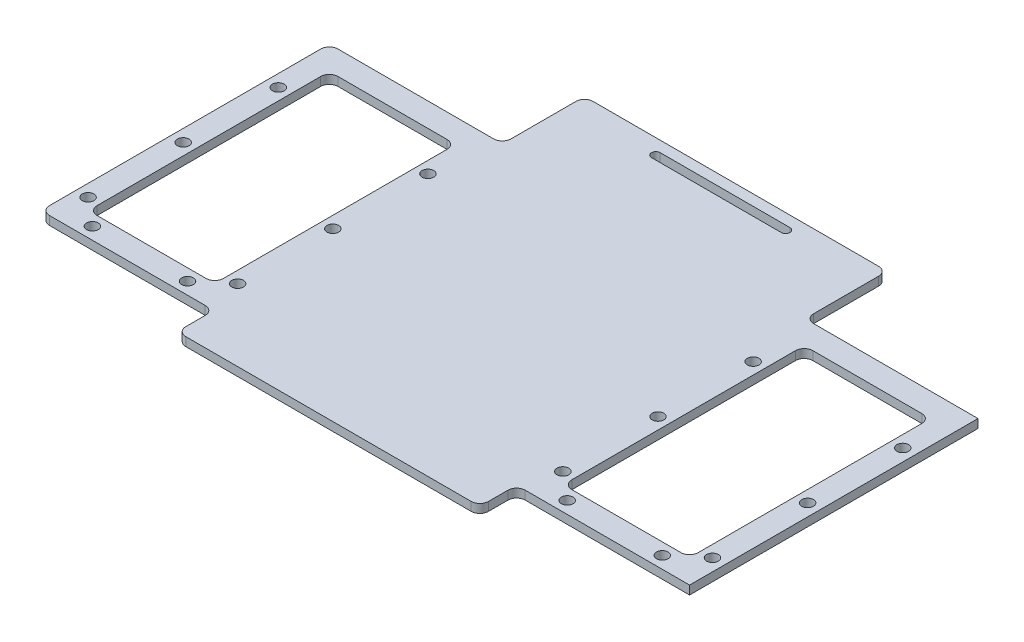
from build123d import *

# Parameters (mm, degrees)
SKETCH_1_R      = 1.35
SKETCH_1_W      = 29.2
SKETCH_1_H      = 55.7
EXTRUDE_1_DEPTH = 2
FILLET_1_R      = 2


with BuildPart() as part:
    # 草图1 → 凸台-拉伸1 (new body)
    with BuildSketch(Plane(origin=(0, 0, 0), x_dir=(1, 0, 0), z_dir=(0, 1, 0))):
        Polygon((-35, -33.35), (-35, -41.85), (35, -41.85), (35, -33.35), (75, -33.35), (75, 33.35), (35, 33.35), (35, 52.35), (-35, 52.35), (-35, 33.35), (-75, 33.35), (-75, -33.35), align=None)
        with Locations(Location((-72.2, 18.75, 0), (0, 0, 270))):
            Circle(SKETCH_1_R, mode=Mode.SUBTRACT)
        with Locations(Location((-72.2, -3.25, 0), (0, 0, 270))):
            Circle(SKETCH_1_R, mode=Mode.SUBTRACT)
        with Locations(Location((-72.2, -25.25, 0), (0, 0, 270))):
            Circle(SKETCH_1_R, mode=Mode.SUBTRACT)
        with Locations(Location((-37.6, -25.25, 0), (0, 0, 90))):
            Circle(SKETCH_1_R, mode=Mode.SUBTRACT)
        with Locations(Location((-37.6, -3.25, 0), (0, 0, 90))):
            Circle(SKETCH_1_R, mode=Mode.SUBTRACT)
        with Locations(Location((-37.6, 18.75, 0), (0, 0, 90))):
            Circle(SKETCH_1_R, mode=Mode.SUBTRACT)
        with Locations(Location((37.6, 18.75, 0), (0, 0, 270))):
            Circle(SKETCH_1_R, mode=Mode.SUBTRACT)
        with Locations(Location((37.6, -3.25, 0), (0, 0, 270))):
            Circle(SKETCH_1_R, mode=Mode.SUBTRACT)
        with Locations(Location((37.6, -25.25, 0), (0, 0, 270))):
            Circle(SKETCH_1_R, mode=Mode.SUBTRACT)
        with Locations(Location((72.2, -25.25, 0), (0, 0, 90))):
            Circle(SKETCH_1_R, mode=Mode.SUBTRACT)
        with Locations(Location((72.2, -3.25, 0), (0, 0, 90))):
            Circle(SKETCH_1_R, mode=Mode.SUBTRACT)
        with Locations(Location((72.2, 18.75, 0), (0, 0, 90))):
            Circle(SKETCH_1_R, mode=Mode.SUBTRACT)
        with Locations(Location((-43.9, -30.55, 0), (0, 0, 270))):
            Circle(SKETCH_1_R, mode=Mode.SUBTRACT)
        with Locations(Location((-65.9, -30.55, 0), (0, 0, 90))):
            Circle(SKETCH_1_R, mode=Mode.SUBTRACT)
        with Locations(Location((43.9, -30.55, 0), (0, 0, 90))):
            Circle(SKETCH_1_R, mode=Mode.SUBTRACT)
        with Locations(Location((65.9, -30.55, 0), (0, 0, 270))):
            Circle(SKETCH_1_R, mode=Mode.SUBTRACT)
        with Locations((-54.9, 0)):
            Rectangle(SKETCH_1_W, SKETCH_1_H, mode=Mode.SUBTRACT)
        with Locations((54.9, 0)):
            Rectangle(SKETCH_1_W, SKETCH_1_H, mode=Mode.SUBTRACT)
        with BuildLine():
            Line((-15, 49.85), (15, 49.85))
            ThreePointArc((15, 49.85), (16, 48.85), (15, 47.85))
            Line((15, 47.85), (-15, 47.85))
            ThreePointArc((-15, 47.85), (-16, 48.85), (-15, 49.85))
        make_face(mode=Mode.SUBTRACT)
    extrude(amount=EXTRUDE_1_DEPTH)

    # 圆角1
    fillet_1_edges = [part.edges().sort_by_distance(p)[0] for p in [
        (-35, 1, -52.35),
        (35, 1, -52.35),
        (35, 1, -33.35),
        (35, 1, 33.35),
        (35, 1, 41.85),
        (-35, 1, 41.85),
        (-35, 1, 33.35),
        (-75, 1, 33.35),
        (-75, 1, -33.35),
        (-35, 1, -33.35),
        (-40.3, 1, 27.85),
        (-40.3, 1, -27.85),
        (-69.5, 1, -27.85),
        (-69.5, 1, 27.85),
        (69.5, 1, 27.85),
        (69.5, 1, -27.85),
        (40.3, 1, -27.85),
        (40.3, 1, 27.85),
    ]]
    fillet(fillet_1_edges, radius=FILLET_1_R)


solid = part.part
